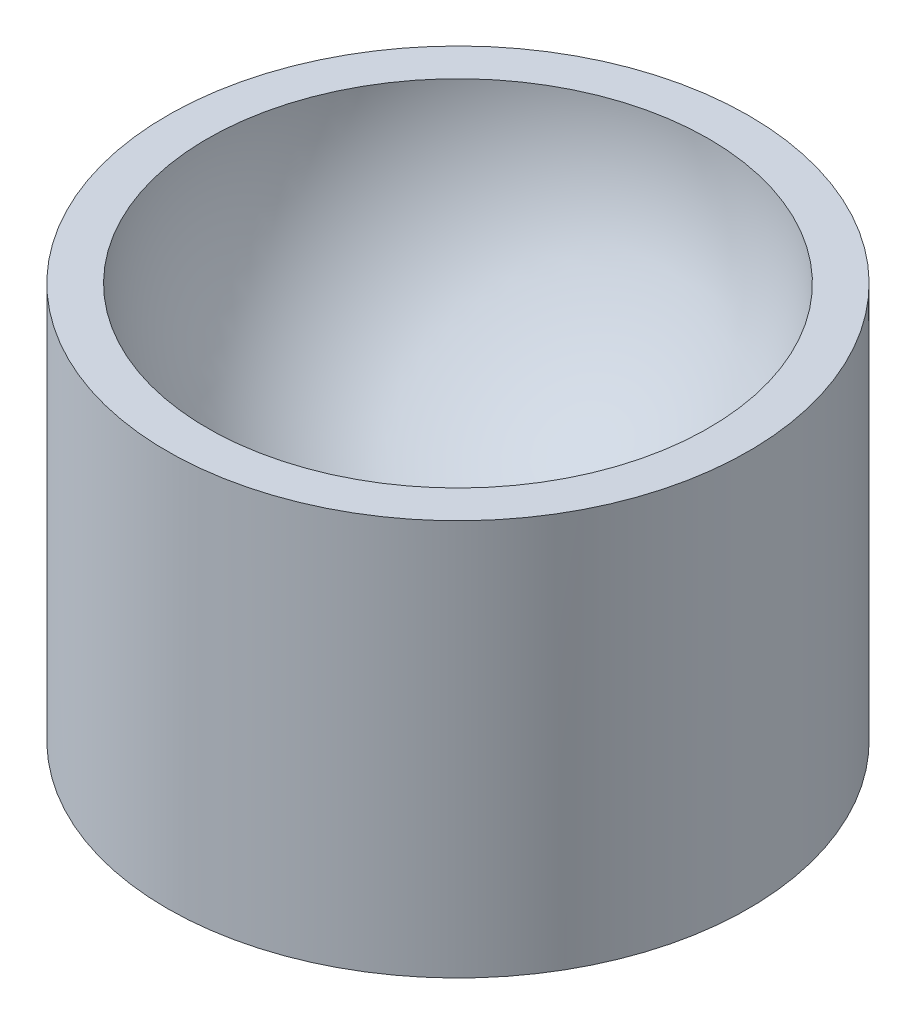
from build123d import *

# Parameters (mm, degrees)
SKETCH2_R           = 29
BOSS_EXTRUDE1_DEPTH = 11.5
SKETCH3_R           = 8
CUT_EXTRUDE1_DEPTH  = 7


with BuildPart() as part:
    # Sketch2 → Boss-Extrude1 (new body)
    with BuildSketch(Plane(origin=(0, 0, 0), x_dir=(1, 0, 0), z_dir=(0, 1, 0))):
        with Locations(Location((0, 0, 0), (0, 0, 270))):
            Circle(SKETCH2_R)
        Polygon((0, 7.505553499), (-6.5, 3.75277675), (-6.5, -3.75277675), (0, -7.505553499), (6.5, -3.75277675), (6.5, 3.75277675), align=None, mode=Mode.SUBTRACT)
    extrude(amount=BOSS_EXTRUDE1_DEPTH)

    # Sketch3 → Cut-Extrude1 (cut)
    with BuildSketch(Plane.XZ):
        with Locations(Location((0, 0, 0), (0, 0, 270))):
            Circle(SKETCH3_R)
    extrude(amount=-CUT_EXTRUDE1_DEPTH, mode=Mode.SUBTRACT)

    # Sketch4 → Revolve1 (revolve)
    with BuildSketch(Plane.XY, mode=Mode.PRIVATE) as revolve1_sk:
        with BuildLine():
            Line((4.05, 14.830231051), (4.05, 11.5))
            Line((4.05, 11.5), (29, 11.5))
            Line((29, 11.5), (29, 39.5))
            Line((29, 39.5), (25, 39.5))
            ThreePointArc((25, 39.5), (19.055839, 23.317447667), (4.05, 14.830231051))
        make_face()
    revolve(revolve1_sk.sketch.rotate(Axis((0, 0, 0), (0, 1, 0)), 90), axis=Axis((0, 0, 0), (0, 1, 0)))


solid = part.part
